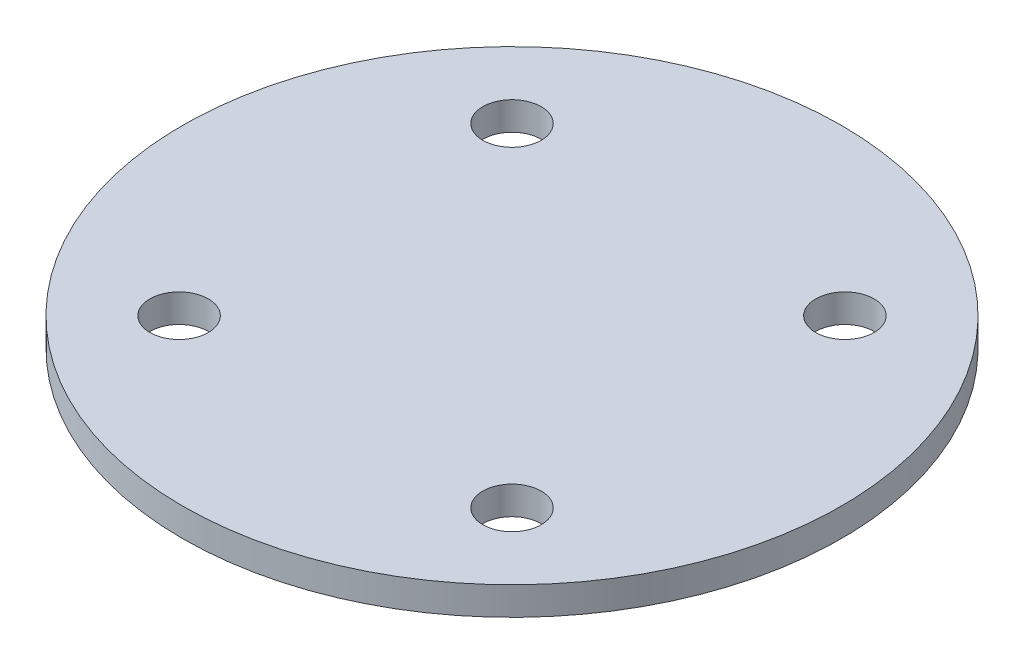
from build123d import *

# Parameters (mm, degrees)
SKETCH1_R           = 35
BOSS_EXTRUDE1_DEPTH = 5
SKETCH2_R           = 3.1
CUT_EXTRUDE1_DEPTH  = 50.749371855
SKETCH5_R           = 35
CUT_EXTRUDE4_DEPTH  = 2


with BuildPart() as part:
    # Sketch1 → Boss-Extrude1 (new body)
    with BuildSketch(Plane(origin=(0, 0, 0), x_dir=(1, 0, 0), z_dir=(0, 1, 0))):
        with Locations(Location((0, 0, 0), (0, 0, 270))):
            Circle(SKETCH1_R)
    extrude(amount=BOSS_EXTRUDE1_DEPTH)

    # Sketch2 → Cut-Extrude1 (cut, through all)
    with BuildSketch(Plane(origin=(0, 5, 0), x_dir=(1, 0, 0), z_dir=(0, 1, 0))):
        with Locations(Location((-17.67766953, 17.67766953, 0), (0, 0, 270))):
            Circle(SKETCH2_R)
        with Locations(Location((17.67766953, 17.67766953, 0), (0, 0, 270))):
            Circle(SKETCH2_R)
        with Locations(Location((17.67766953, -17.67766953, 0), (0, 0, 270))):
            Circle(SKETCH2_R)
        with Locations(Location((-17.67766953, -17.67766953, 0), (0, 0, 270))):
            Circle(SKETCH2_R)
    extrude(amount=-CUT_EXTRUDE1_DEPTH, mode=Mode.SUBTRACT)

    # Sketch5 → Cut-Extrude4 (cut)
    with BuildSketch(Plane.XZ):
        with Locations(Location((0, 0, 0), (0, 0, 90))):
            Circle(SKETCH5_R)
    extrude(amount=-CUT_EXTRUDE4_DEPTH, mode=Mode.SUBTRACT)


solid = part.part
